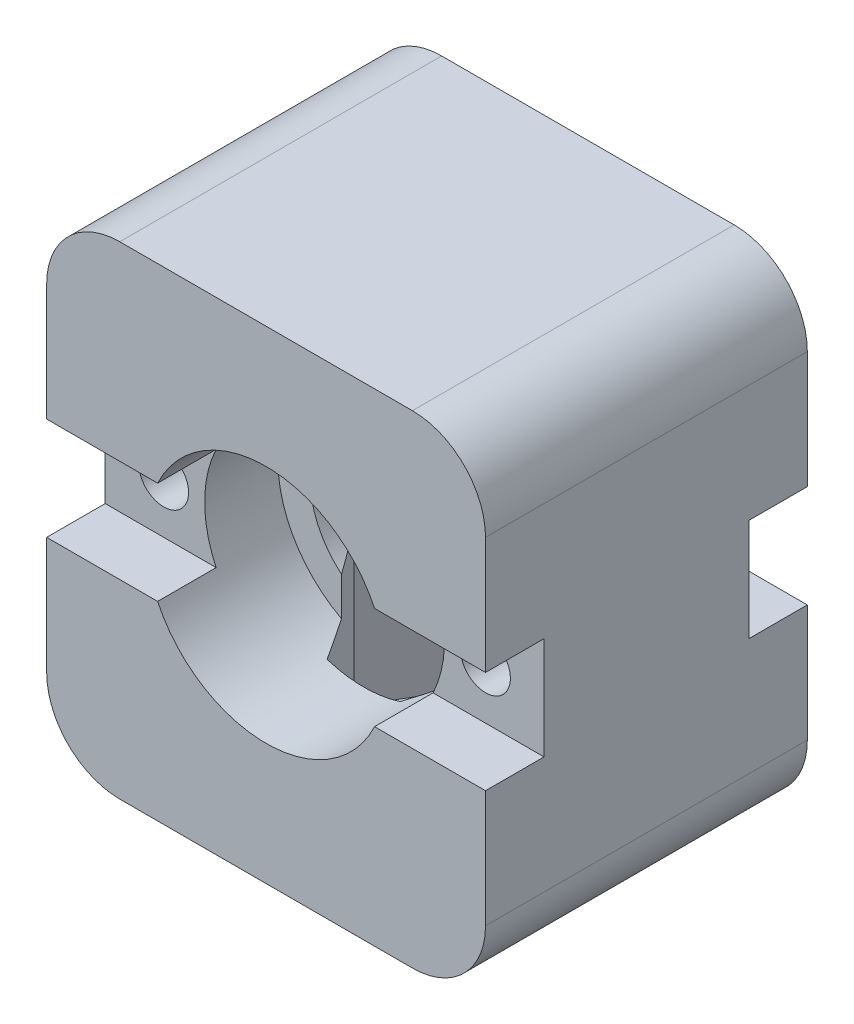
from build123d import *

# Parameters (mm, degrees)
SALIENTE_EXTRUIR2_DEPTH      = 11
SALIENTE_EXTRUIR2_DEPTH_BACK = 11
CROQUIS4_R                   = 6
CROQUIS4_R_2                 = 1.7
CORTAR_EXTRUIR2_DEPTH        = 33
CROQUIS5_R                   = 8.2
CORTAR_EXTRUIR3_DEPTH        = 9
CROQUIS6_W                   = 30.6
CROQUIS6_H                   = 7
CORTAR_EXTRUIR4_DEPTH        = 4
CORTAR_EXTRUIR6_DEPTH        = 14
CROQUIS9_R                   = 2.6
CORTAR_EXTRUIR7_DEPTH        = 5


with BuildPart() as part:
    # Croquis2 → Saliente-Extruir2 (new, two sides: drawn at the far end of the back side and taken through both)
    with BuildSketch(Plane.XY.offset(-SALIENTE_EXTRUIR2_DEPTH_BACK)):
        with BuildLine():
            Line((-15, -1.5), (-15, 1.5))
            Line((-15, 1.5), (-15, 11.5))
            ThreePointArc((-15, 11.5), (-13.535533906, 15.035533906), (-10, 16.5))
            Line((-10, 16.5), (10, 16.5))
            ThreePointArc((10, 16.5), (13.535533906, 15.035533906), (15, 11.5))
            Line((15, 11.5), (15, 1.5))
            Line((15, 1.5), (15, -1.5))
            Line((15, -1.5), (15, -11.5))
            ThreePointArc((15, -11.5), (13.535533906, -15.035533906), (10, -16.5))
            Line((10, -16.5), (-10, -16.5))
            ThreePointArc((-10, -16.5), (-13.535533906, -15.035533906), (-15, -11.5))
            Line((-15, -11.5), (-15, -1.5))
        make_face()
    extrude(amount=SALIENTE_EXTRUIR2_DEPTH + SALIENTE_EXTRUIR2_DEPTH_BACK)

    # Croquis4 → Cortar-Extruir2 (cut)
    with BuildSketch(Plane(origin=(0, 0, -11), x_dir=(-1, 0, 0), z_dir=(0, 0, -1))):
        Circle(CROQUIS4_R)
        with Locations((-11, 0)):
            Circle(CROQUIS4_R_2)
        with Locations((11, 0)):
            Circle(CROQUIS4_R_2)
    extrude(amount=-CORTAR_EXTRUIR2_DEPTH, mode=Mode.SUBTRACT)

    # Croquis5 → Cortar-Extruir3 (cut)
    with BuildSketch(Plane.XY.offset(11)):
        Circle(CROQUIS5_R)
    cortar_extruir3 = extrude(amount=-CORTAR_EXTRUIR3_DEPTH, mode=Mode.SUBTRACT)

    # Croquis6 → Cortar-Extruir4 (cut)
    with BuildSketch(Plane.XY.offset(11)):
        Rectangle(CROQUIS6_W, CROQUIS6_H)
    cortar_extruir4 = extrude(amount=-CORTAR_EXTRUIR4_DEPTH, mode=Mode.SUBTRACT)

    # Croquis8 → Cortar-Extruir6 (cut)
    with BuildSketch(Plane(origin=(0, 0, 0), x_dir=(1, 0, 0), z_dir=(0, 1, 0))):
        Polygon((5, 0), (2.5, 4.330127019), (-2.5, 4.330127019), (-5, 0), (-2.5, -4.330127019), (2.5, -4.330127019), align=None)
    extrude(amount=-CORTAR_EXTRUIR6_DEPTH, mode=Mode.SUBTRACT)

    # Croquis9 → Cortar-Extruir7 (cut)
    with BuildSketch(Plane.XZ.offset(16.5)):
        Circle(CROQUIS9_R)
    extrude(amount=-CORTAR_EXTRUIR7_DEPTH, mode=Mode.SUBTRACT)

    # Simetría1: Cortar-Extruir3, Cortar-Extruir4 across plane
    add(cortar_extruir3.mirror(Plane.XY), mode=Mode.SUBTRACT)
    add(cortar_extruir4.mirror(Plane.XY), mode=Mode.SUBTRACT)


solid = part.part
